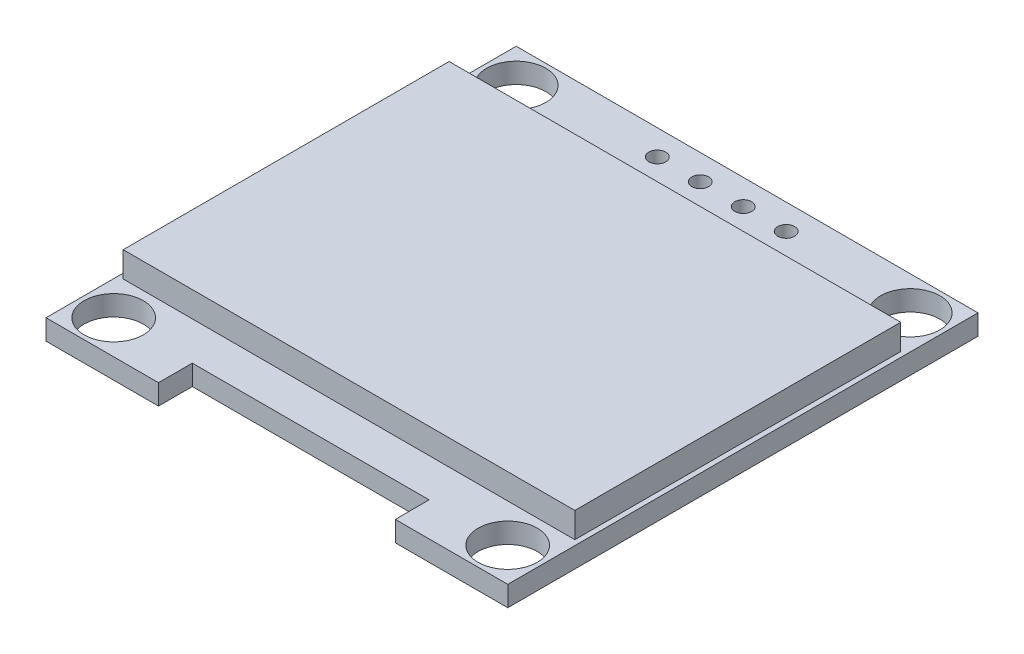
from build123d import *

# Parameters (mm, degrees)
ESQUISSE1_R             = 1.75
ESQUISSE1_R_2           = 0.5
BOSS_EXTRU_2_DEPTH      = 1.2
ESQUISSE9_W             = 26.7
ESQUISSE9_H             = 19.268
BOSS_EXTRU_3_DEPTH      = 1.5
ENL_V_MAT_EXTRU_1_DEPTH = 0.5


with BuildPart() as part:
    # Esquisse1 → Boss.-Extru.2 (new body)
    with BuildSketch(Plane(origin=(0, 0, 0), x_dir=(1, 0, 0), z_dir=(0, 1, 0))):
        Polygon((0, 0), (0, 27.8), (27.3, 27.8), (27.3, 0), (20.65, 0), (20.65, 2.0001046), (6.65, 2.0001046), (6.65, 0), align=None)
        with Locations(Location((25.29519694, 2.0001046, 0), (0, 0, 270))):
            Circle(ESQUISSE1_R, mode=Mode.SUBTRACT)
        with Locations(Location((2.002692778, 2.0001046, 0), (0, 0, 270))):
            Circle(ESQUISSE1_R, mode=Mode.SUBTRACT)
        with Locations(Location((25.29519694, 25.8, 0), (0, 0, 270))):
            Circle(ESQUISSE1_R, mode=Mode.SUBTRACT)
        with Locations(Location((2, 25.8, 0), (0, 0, 270))):
            Circle(ESQUISSE1_R, mode=Mode.SUBTRACT)
        with Locations(Location((9.84, 26.3, 0), (0, 0, 270))):
            Circle(ESQUISSE1_R_2, mode=Mode.SUBTRACT)
        with Locations(Location((17.46, 26.3, 0), (0, 0, 270))):
            Circle(ESQUISSE1_R_2, mode=Mode.SUBTRACT)
        with Locations(Location((12.38, 26.3, 0), (0, 0, 270))):
            Circle(ESQUISSE1_R_2, mode=Mode.SUBTRACT)
        with Locations(Location((14.92, 26.3, 0), (0, 0, 270))):
            Circle(ESQUISSE1_R_2, mode=Mode.SUBTRACT)
    extrude(amount=BOSS_EXTRU_2_DEPTH)

    # Esquisse9 → Boss.-Extru.3 (add)
    with BuildSketch(Plane(origin=(0, 1.2, 0), x_dir=(1, 0, 0), z_dir=(0, 1, 0))):
        with Locations((13.64759847, 13.9000523)):
            Rectangle(ESQUISSE9_W, ESQUISSE9_H)
    extrude(amount=BOSS_EXTRU_3_DEPTH)

    # Esquisse10 → Enlèv. mat.-Extru.1 (cut)
    # profile 1 of 8: a face of its own
    with BuildSketch(Plane(origin=(27.506922767, 0, -25.389295394), x_dir=(-1, 0, 0), z_dir=(0, -1, 0))):
        with BuildLine():
            add(Edge.make_bspline(
                [(4.410667941, -14.644029634), (4.475476047, -14.645671114), (4.602764514, -14.648895114), (4.789839411, -14.673574218), (4.968434507, -14.716269608), (5.140004645, -14.77313259), (5.302497622, -14.848986976), (5.457136514, -14.940672124), (5.603553388, -15.049148583), (5.73977477, -15.17357781), (5.86443172, -15.308961264), (5.974257606, -15.453439174), (6.0662999, -15.606137976), (6.141885687, -15.766598807), (6.201184297, -15.934458775), (6.242103341, -16.110612777), (6.268241491, -16.293919468), (6.271297268, -16.418946332), (6.272847428, -16.48237098)],
                knots=[0, 0, 0, 0, 1.065120563, 2.091984664, 3.0946048, 4.079830382, 5.057816894, 6.036188127, 7.030412546, 8.04752943, 9.064399622, 10.05169764, 11.02544977, 11.989514704, 12.962713494, 13.945757189, 14.957906945, 16, 16, 16, 16], degree=3))
            add(Edge.make_bspline(
                [(6.272847428, -16.48237098), (6.271297495, -16.545328427), (6.268242399, -16.669424847), (6.242073621, -16.851568291), (6.201032621, -17.026658988), (6.142436355, -17.194404641), (6.067210877, -17.354982204), (5.974555706, -17.507969158), (5.865414495, -17.653415657), (5.741207644, -17.789728322), (5.605806602, -17.914725793), (5.460576335, -18.023644668), (5.308783015, -18.117368793), (5.148473307, -18.192152467), (4.98177327, -18.251924387), (4.807190947, -18.292677017), (4.625544393, -18.31896406), (4.501673389, -18.321982576), (4.438712813, -18.323516814)],
                knots=[0, 0, 0, 0, 1.043624062, 2.057103931, 3.04512605, 4.022047818, 4.998200453, 5.980619268, 6.982898556, 8.009068085, 9.034988726, 10.034168286, 11.015286542, 11.987931943, 12.962482838, 13.94673481, 14.956375938, 16, 16, 16, 16], degree=3))
            add(Edge.make_bspline(
                [(4.438712813, -18.323516814), (4.375288494, -18.321967427), (4.250262278, -18.318913173), (4.066725242, -18.292731768), (3.890447498, -18.251790464), (3.721933147, -18.193281028), (3.561088218, -18.117663797), (3.407598135, -18.025459418), (3.262078988, -17.916052277), (3.125737241, -17.791885703), (3.000988043, -17.656714151), (2.892228667, -17.511879895), (2.800003554, -17.360224439), (2.724640221, -17.201326915), (2.664975762, -17.035955472), (2.624270944, -16.863006994), (2.597934992, -16.683467489), (2.594900145, -16.56122459), (2.593360248, -16.499197903)],
                knots=[0, 0, 0, 0, 1.053102029, 2.075944431, 3.073151272, 4.055350789, 5.033113405, 6.020478099, 7.024410459, 8.052272461, 9.079885166, 10.07527673, 11.055994387, 12.023226415, 12.992069828, 13.970394897, 14.97016774, 16, 16, 16, 16], degree=3))
            add(Edge.make_bspline(
                [(2.593360248, -16.499197903), (2.593894884, -16.457565234), (2.59495741, -16.374825111), (2.607749103, -16.251958511), (2.626310804, -16.131067853), (2.652912717, -16.012496905), (2.687704384, -15.89653592), (2.728756411, -15.782385157), (2.778896256, -15.671201434), (2.835576904, -15.562458042), (2.898838712, -15.457850136), (2.968714462, -15.358970553), (3.04274983, -15.264989556), (3.123913224, -15.178342552), (3.209529669, -15.096508896), (3.300988047, -15.020746179), (3.397730292, -14.950371228), (3.500172671, -14.886950887), (3.605790946, -14.829591752), (3.714667724, -14.780369901), (3.825324295, -14.73812384), (3.938278943, -14.703883015), (4.053231715, -14.676850979), (4.1704335, -14.658443625), (4.289790926, -14.645619307), (4.370202245, -14.644561805), (4.410667941, -14.644029634)],
                knots=[0, 0, 0, 0, 1.037015668, 2.060948919, 3.074880161, 4.083647147, 5.086022904, 6.090072063, 7.104153813, 8.122640571, 9.144368836, 10.147691507, 11.138137339, 12.123020368, 13.103399296, 14.087645067, 15.080126199, 16.082011238, 17.087798457, 18.072939717, 19.057185487, 20.037253025, 21.01195951, 21.997135196, 22.992090687, 24, 24, 24, 24], degree=3))
        make_face()
        with BuildLine():
            add(Edge.make_bspline(
                [(4.42609262, -15.003003993), (4.392877987, -15.003408883), (4.326766254, -15.004214793), (4.228481718, -15.014830509), (4.131489784, -15.029960398), (4.035770422, -15.051541918), (3.941724132, -15.080945971), (3.848474291, -15.114786879), (3.756871237, -15.15600797), (3.667217379, -15.202580674), (3.580302304, -15.254129595), (3.498289603, -15.311101362), (3.420966959, -15.372159916), (3.348523692, -15.437447754), (3.28117252, -15.507297356), (3.217587818, -15.580649792), (3.160318237, -15.659601683), (3.10783266, -15.74201209), (3.06086482, -15.827773671), (3.019099465, -15.915983533), (2.984935456, -16.00736122), (2.95707308, -16.100915378), (2.933973269, -16.196497837), (2.919339345, -16.294833686), (2.908606985, -16.395428798), (2.90784714, -16.463410652), (2.907462813, -16.49779566)],
                knots=[0, 0, 0, 0, 1.008559885, 2.007477868, 2.99961109, 3.989939068, 4.984837346, 5.991145699, 7.001802488, 8.033829008, 9.059044045, 10.069351652, 11.065060232, 12.050310815, 13.029377138, 14.011219647, 14.996725999, 15.989392538, 16.977580475, 17.965360261, 18.951710183, 19.937753436, 20.929683414, 21.935841486, 22.955955122, 24, 24, 24, 24], degree=3))
            add(Edge.make_bspline(
                [(2.907462813, -16.49779566), (2.908737675, -16.548357881), (2.911245722, -16.647829411), (2.933203292, -16.793597555), (2.967025267, -16.933685841), (3.016882633, -17.06732775), (3.079233248, -17.195672033), (3.156260138, -17.317580138), (3.247519224, -17.433085012), (3.35118275, -17.541380281), (3.464505457, -17.640226086), (3.584838187, -17.726989494), (3.710891794, -17.800399744), (3.842994997, -17.860204816), (3.980442536, -17.907594554), (4.124120087, -17.940073185), (4.273070547, -17.961448641), (4.374601202, -17.963501397), (4.42609262, -17.964542455)],
                knots=[0, 0, 0, 0, 1.032063989, 2.030389145, 3.003944642, 3.970395727, 4.937377036, 5.913328081, 6.909231446, 7.93887556, 8.970685674, 9.976071282, 10.964166581, 11.944589148, 12.933237628, 13.927779006, 14.949070134, 16, 16, 16, 16], degree=3))
            add(Edge.make_bspline(
                [(4.42609262, -17.964542455), (4.460702122, -17.96406695), (4.529343158, -17.963123882), (4.631438681, -17.953625206), (4.731694892, -17.938393336), (4.829971172, -17.916462681), (4.926155984, -17.889015474), (5.020650787, -17.856407746), (5.112449077, -17.815726542), (5.202708915, -17.770778591), (5.289105157, -17.719538433), (5.371580689, -17.664500284), (5.448056669, -17.603531663), (5.52044574, -17.53921385), (5.588073429, -17.470250003), (5.650482413, -17.396729781), (5.707462545, -17.318189123), (5.759928192, -17.235903718), (5.806731455, -17.149907465), (5.847510554, -17.061377787), (5.88210667, -16.970532678), (5.910035175, -16.877241106), (5.931920636, -16.781680257), (5.947000556, -16.683722179), (5.957548995, -16.583562837), (5.958344072, -16.515818981), (5.958744864, -16.481669859)],
                knots=[0, 0, 0, 0, 1.047197238, 2.076906641, 3.100256066, 4.114471768, 5.12198147, 6.126382909, 7.136867548, 8.15857795, 9.17633901, 10.174870724, 11.156907918, 12.133735059, 13.104061851, 14.077631395, 15.04955518, 16.038496417, 17.029181396, 18.010275684, 18.986308667, 19.968651475, 20.955262928, 21.950658345, 22.966943676, 24, 24, 24, 24], degree=3))
            add(Edge.make_bspline(
                [(5.958744864, -16.481669859), (5.958343751, -16.447754354), (5.957548069, -16.380476704), (5.947005595, -16.281015886), (5.931904704, -16.183762674), (5.910141996, -16.089098871), (5.882091843, -15.997000346), (5.847504512, -15.907553599), (5.806719213, -15.820425403), (5.759910988, -15.735831106), (5.707295165, -15.654656368), (5.649800922, -15.577053956), (5.586435573, -15.504481215), (5.519009549, -15.435146521), (5.445838663, -15.370528631), (5.367254369, -15.31060611), (5.284210691, -15.253932836), (5.196283456, -15.202807274), (5.105539502, -15.155593041), (5.012425544, -15.115142038), (4.917996445, -15.080769919), (4.822492332, -15.051452954), (4.725109354, -15.030044924), (4.626505525, -15.014816874), (4.526817267, -15.004218488), (4.459774047, -15.003410109), (4.42609262, -15.003003993)],
                knots=[0, 0, 0, 0, 1.02996197, 2.043119294, 3.035359645, 4.018872909, 4.991431989, 5.957985074, 6.929999688, 7.912076566, 8.892894881, 9.867085534, 10.843653904, 11.817741046, 12.803660682, 13.806313499, 14.818574707, 15.856120519, 16.894564902, 17.924820532, 18.937903209, 19.946497019, 20.957711757, 21.963978472, 22.977135795, 24, 24, 24, 24], degree=3))
        make_face(mode=Mode.SUBTRACT)
    # profile 2 of 8: a face of its own
    with BuildSketch(Plane(origin=(27.506922767, 0, -25.389295394), x_dir=(-1, 0, 0), z_dir=(0, -1, 0))):
        Polygon((6.990796146, -14.733773224), (7.30489871, -14.733773224), (7.30489871, -17.874798865), (8.651052556, -17.874798865), (8.651052556, -18.233773224), (6.990796146, -18.233773224), align=None)
    # profile 3 of 8: a face of its own
    with BuildSketch(Plane(origin=(27.506922767, 0, -25.389295394), x_dir=(-1, 0, 0), z_dir=(0, -1, 0))):
        Polygon((9.234385889, -14.733773224), (11.208744864, -14.733773224), (11.208744864, -15.092747583), (9.548488454, -15.092747583), (9.548488454, -16.16967066), (11.208744864, -16.16967066), (11.208744864, -16.528645019), (9.548488454, -16.528645019), (9.548488454, -17.874798865), (11.208744864, -17.874798865), (11.208744864, -18.233773224), (9.234385889, -18.233773224), align=None)
    # profile 4 of 8: a face of its own
    with BuildSketch(Plane(origin=(27.506922767, 0, -25.389295394), x_dir=(-1, 0, 0), z_dir=(0, -1, 0))):
        with BuildLine():
            Line((11.836949992, -18.233773224), (11.836949992, -14.733773224))
            Line((11.836949992, -14.733773224), (12.543680761, -14.733773224))
            add(Edge.make_bspline(
                [(12.543680761, -14.733773224), (12.605149749, -14.734215794), (12.723907515, -14.735070837), (12.895519962, -14.740492228), (13.054303725, -14.750082694), (13.199736584, -14.76405222), (13.332217796, -14.781205254), (13.451376404, -14.802705658), (13.557828547, -14.828093828), (13.623297987, -14.849739279), (13.654257684, -14.859975147)],
                knots=[0, 0, 0, 0, 1.314313732, 2.53924729, 3.670748893, 4.714932338, 5.66265055, 6.526160246, 7.303039223, 8, 8, 8, 8], degree=3))
            add(Edge.make_bspline(
                [(13.654257684, -14.859975147), (13.694752424, -14.875405853), (13.774823616, -14.905917347), (13.888830738, -14.963473648), (13.996156101, -15.02868675), (14.097375246, -15.101642613), (14.190176073, -15.184406961), (14.278183969, -15.273464047), (14.357798693, -15.372052387), (14.430706989, -15.478127375), (14.496442649, -15.590439427), (14.553581807, -15.708774536), (14.6010358, -15.832531744), (14.640429027, -15.961366892), (14.671475484, -16.09556327), (14.692657416, -16.235277136), (14.706628406, -16.379956325), (14.708032457, -16.478130789), (14.708744864, -16.527943897)],
                knots=[0, 0, 0, 0, 0.984719456, 1.947108742, 2.898477687, 3.838006223, 4.779231079, 5.722358779, 6.681677486, 7.655904652, 8.64651281, 9.637519902, 10.640069247, 11.656948941, 12.698408672, 13.768548281, 14.867775369, 16, 16, 16, 16], degree=3))
            add(Edge.make_bspline(
                [(14.708744864, -16.527943897), (14.708115896, -16.571205136), (14.70687645, -16.656455924), (14.695747134, -16.78209682), (14.679570814, -16.904010391), (14.654526616, -17.021616091), (14.624124103, -17.135944309), (14.585159952, -17.245776554), (14.540524456, -17.352120363), (14.488474577, -17.453537839), (14.431333192, -17.549621211), (14.370011449, -17.640196739), (14.304574753, -17.723971961), (14.234399121, -17.801200573), (14.160391404, -17.871766152), (14.082067073, -17.936258167), (13.999224023, -17.993414722), (13.9122333, -18.04548183), (13.818557171, -18.090902186), (13.716421305, -18.129332195), (13.605390127, -18.161178811), (13.48573617, -18.187749707), (13.357252692, -18.208827009), (13.219813726, -18.222953402), (13.073630436, -18.232506334), (12.973251171, -18.233342728), (12.921585409, -18.233773224)],
                knots=[0, 0, 0, 0, 1.105936401, 2.179363191, 3.223086493, 4.248585256, 5.251745608, 6.245858792, 7.225916811, 8.198733463, 9.158002045, 10.082870192, 10.993790845, 11.873723703, 12.748670949, 13.606408763, 14.465103618, 15.319838547, 16.196477973, 17.123216899, 18.106603292, 19.147568657, 20.255746949, 21.433717677, 22.679120308, 24, 24, 24, 24], degree=3))
            Line((12.921585409, -18.233773224), (11.836949992, -18.233773224))
        make_face()
        with BuildLine():
            Line((12.151052556, -17.874798865), (12.552795345, -17.874798865))
            add(Edge.make_bspline(
                [(12.552795345, -17.874798865), (12.610523715, -17.874550769), (12.721556514, -17.874073588), (12.881214511, -17.869886385), (13.027093908, -17.863044448), (13.159215417, -17.85346937), (13.277504441, -17.840800755), (13.382208191, -17.826675852), (13.472983449, -17.809078401), (13.527912886, -17.793127442), (13.553296146, -17.785756397)],
                knots=[0, 0, 0, 0, 1.375205317, 2.645023457, 3.804390687, 4.853969522, 5.800190428, 6.637939096, 7.370582563, 8, 8, 8, 8], degree=3))
            add(Edge.make_bspline(
                [(13.553296146, -17.785756397), (13.585244508, -17.774504839), (13.648378146, -17.752270466), (13.739259231, -17.711712804), (13.824016236, -17.663670735), (13.904126261, -17.610268461), (13.978452917, -17.549622459), (14.047877033, -17.48305147), (14.112258834, -17.410216695), (14.170933142, -17.331208533), (14.223441446, -17.246518738), (14.268912676, -17.156979904), (14.308764207, -17.063573094), (14.3400428, -16.964863935), (14.364558384, -16.861734877), (14.381923072, -16.754178663), (14.392737797, -16.642215381), (14.393999245, -16.566063257), (14.3946423, -16.527242775)],
                knots=[0, 0, 0, 0, 0.998632004, 1.973411704, 2.929992603, 3.868527914, 4.809262121, 5.754881198, 6.702106254, 7.672490631, 8.653608572, 9.636854334, 10.631411391, 11.644891563, 12.686317036, 13.754757253, 14.855430412, 16, 16, 16, 16], degree=3))
            add(Edge.make_bspline(
                [(14.3946423, -16.527242775), (14.394129012, -16.486309295), (14.393120655, -16.405895111), (14.380446344, -16.287904415), (14.361924789, -16.174423765), (14.335141103, -16.065445569), (14.301010224, -15.960757217), (14.258415582, -15.860937707), (14.209748963, -15.764932838), (14.151845626, -15.674958472), (14.088430033, -15.589865363), (14.018052153, -15.511910448), (13.941830115, -15.440916147), (13.860595265, -15.375776835), (13.772058166, -15.319113159), (13.678304475, -15.268426478), (13.577958804, -15.225410586), (13.508146108, -15.202531724), (13.472667139, -15.190904634)],
                knots=[0, 0, 0, 0, 1.122418816, 2.205001699, 3.251619955, 4.274784885, 5.280384055, 6.268708349, 7.249350384, 8.229342522, 9.199999885, 10.157847722, 11.105861043, 12.055065948, 13.010012805, 13.98527497, 14.976112212, 16, 16, 16, 16], degree=3))
            add(Edge.make_bspline(
                [(13.472667139, -15.190904634), (13.443315993, -15.182788206), (13.380907403, -15.165530454), (13.279067939, -15.146705081), (13.164452789, -15.130100582), (13.036553088, -15.116042543), (12.895514629, -15.105955222), (12.741228941, -15.098383907), (12.573629337, -15.093277274), (12.457446803, -15.092928567), (12.397146306, -15.092747583)],
                knots=[0, 0, 0, 0, 0.674548936, 1.434276114, 2.292660221, 3.240891867, 4.284742987, 5.42552168, 6.663806718, 8, 8, 8, 8], degree=3))
            Line((12.397146306, -15.092747583), (12.151052556, -15.092747583))
            Line((12.151052556, -15.092747583), (12.151052556, -17.874798865))
        make_face(mode=Mode.SUBTRACT)
    # profile 5 of 8: a face of its own
    with BuildSketch(Plane(origin=(27.506922767, 0, -25.389295394), x_dir=(-1, 0, 0), z_dir=(0, -1, 0))):
        with BuildLine():
            add(Edge.make_bspline(
                [(16.458744864, -16.485175468), (16.459072882, -16.42907808), (16.459710062, -16.320108096), (16.466798483, -16.161323453), (16.478573825, -16.012363164), (16.494711198, -15.873220098), (16.514349178, -15.743858334), (16.540564665, -15.624623577), (16.570377468, -15.51496397), (16.604929913, -15.414521922), (16.643917702, -15.321944219), (16.686351963, -15.235519017), (16.733916758, -15.155377085), (16.78389367, -15.080239295), (16.838305742, -15.0113356), (16.895604533, -14.947692937), (16.958026409, -14.890782187), (17.023449417, -14.838935884), (17.092465881, -14.793486413), (17.163108548, -14.753453674), (17.235863653, -14.719253807), (17.310929836, -14.692363371), (17.387632394, -14.670152524), (17.466239461, -14.654963577), (17.546880825, -14.645406668), (17.60131226, -14.644493), (17.628917139, -14.644029634)],
                knots=[0, 0, 0, 0, 1.646270934, 3.197905019, 4.663502075, 6.030701355, 7.308322542, 8.50163776, 9.611534131, 10.641858119, 11.616356847, 12.558055219, 13.465016945, 14.349605745, 15.204443733, 16.039544428, 16.859896111, 17.680448484, 18.487036065, 19.28249412, 20.06191084, 20.843045899, 21.620316918, 22.403196591, 23.190181807, 24, 24, 24, 24], degree=3))
            add(Edge.make_bspline(
                [(17.628917139, -14.644029634), (17.656752618, -14.644517449), (17.712108627, -14.64548756), (17.793949002, -14.654811503), (17.873898684, -14.670282626), (17.951616823, -14.6922036), (18.027741809, -14.719399277), (18.101678217, -14.753486394), (18.173885298, -14.793165262), (18.243215586, -14.839789139), (18.310430201, -14.891771415), (18.373878164, -14.950534084), (18.43356525, -15.015483803), (18.490240555, -15.085925667), (18.542296153, -15.163210752), (18.591869585, -15.245994862), (18.636241621, -15.335725727), (18.678976296, -15.430906194), (18.715863283, -15.534169853), (18.749129528, -15.644934614), (18.776008496, -15.764508801), (18.798397769, -15.892265046), (18.815742665, -16.028672529), (18.828375307, -16.173438845), (18.835048392, -16.326659235), (18.836305093, -16.431417084), (18.836949992, -16.485175468)],
                knots=[0, 0, 0, 0, 0.810914788, 1.612654377, 2.396697861, 3.181598691, 3.963628158, 4.749916497, 5.551656086, 6.361998678, 7.18212741, 8.025565596, 8.878627764, 9.750805457, 10.657531673, 11.591944965, 12.560506719, 13.57287815, 14.630710178, 15.753379473, 16.941251878, 18.199788006, 19.531962791, 20.947069417, 22.433333509, 24, 24, 24, 24], degree=3))
            add(Edge.make_bspline(
                [(18.836949992, -16.485175468), (18.836298407, -16.538699375), (18.835028822, -16.642988527), (18.828450115, -16.795519503), (18.815491484, -16.939517546), (18.799281495, -17.075328008), (18.776830532, -17.202385627), (18.749225366, -17.321130076), (18.718575043, -17.432074147), (18.680740249, -17.534308959), (18.639329539, -17.629260682), (18.594274343, -17.71792783), (18.546004517, -17.801094123), (18.493415772, -17.87809387), (18.437362358, -17.949472527), (18.37664457, -18.01397015), (18.312973984, -18.073140821), (18.245561569, -18.125792449), (18.175150017, -18.171877254), (18.10319094, -18.213091104), (18.028407557, -18.246323799), (17.952494604, -18.27485884), (17.874366238, -18.296659292), (17.794119848, -18.311733147), (17.712163612, -18.322304996), (17.656762047, -18.323111476), (17.628917139, -18.323516814)],
                knots=[0, 0, 0, 0, 1.561518951, 3.042555995, 4.452378317, 5.7783523, 7.031515105, 8.214008947, 9.334062868, 10.386615937, 11.391082383, 12.354592575, 13.286541444, 14.194233754, 15.072674879, 15.931287219, 16.775624067, 17.606195743, 18.42308326, 19.229000347, 20.022332153, 20.807536673, 21.593273796, 22.3848459, 23.188221202, 24, 24, 24, 24], degree=3))
            add(Edge.make_bspline(
                [(17.628917139, -18.323516814), (17.601313025, -18.323050458), (17.546883101, -18.322130896), (17.466230675, -18.312617165), (17.387948232, -18.297321662), (17.311649478, -18.275905058), (17.236942963, -18.249690221), (17.164846676, -18.215536538), (17.094558992, -18.176202469), (17.026267436, -18.131407047), (16.961255275, -18.080085364), (16.89915667, -18.023321075), (16.841531651, -17.959697664), (16.787897555, -17.890219741), (16.736923467, -17.815526499), (16.690034094, -17.734598126), (16.64666324, -17.647755515), (16.607019749, -17.554437604), (16.571871086, -17.453282677), (16.540823377, -17.343133498), (16.51630922, -17.223017862), (16.495326265, -17.093900495), (16.478401882, -16.955226564), (16.466847556, -16.806920786), (16.459706241, -16.649075577), (16.459071171, -16.540805803), (16.458744864, -16.485175468)],
                knots=[0, 0, 0, 0, 0.810891512, 1.598919785, 2.382837074, 3.152667961, 3.926044502, 4.706494248, 5.493654104, 6.291793342, 7.103789334, 7.925228297, 8.761435821, 9.622817696, 10.50288917, 11.416980706, 12.369136599, 13.353924996, 14.394355917, 15.514179734, 16.714354668, 17.994756427, 19.357759367, 20.818452758, 22.365282078, 24, 24, 24, 24], degree=3))
        make_face()
        with BuildLine():
            add(Edge.make_bspline(
                [(16.772847428, -16.483773224), (16.772966875, -16.530521923), (16.773198698, -16.621251968), (16.779254899, -16.753095229), (16.787505131, -16.876065557), (16.798146428, -16.990319094), (16.813949377, -17.095469106), (16.831656164, -17.192238789), (16.853204254, -17.280116026), (16.878699272, -17.359703837), (16.907738369, -17.432352906), (16.939444232, -17.499954121), (16.973504955, -17.563306057), (17.011624106, -17.621839666), (17.053139169, -17.67574583), (17.097112428, -17.725978662), (17.145185013, -17.770775643), (17.211688755, -17.824502498), (17.299485229, -17.880021632), (17.410105685, -17.928367722), (17.523774136, -17.958750178), (17.600925386, -17.962613934), (17.639433966, -17.964542455)],
                knots=[0, 0, 0, 0, 1.459021318, 2.831673884, 4.118529203, 5.306027144, 6.411944654, 7.436330062, 8.375795394, 9.233974572, 10.042671642, 10.816086306, 11.563610507, 12.285937304, 12.993564865, 13.685989202, 14.367179055, 15.041617293, 16.353048772, 17.594441528, 18.799311195, 20, 20, 20, 20], degree=3))
            add(Edge.make_bspline(
                [(17.639433966, -17.964542455), (17.678191638, -17.962944674), (17.755626961, -17.959752411), (17.868760756, -17.928953674), (17.978591026, -17.882484134), (18.064662967, -17.827536629), (18.13014551, -17.775208299), (18.1770625, -17.730593651), (18.220124549, -17.680637784), (18.260966624, -17.626738488), (18.298425699, -17.567866004), (18.332488837, -17.504303428), (18.363572185, -17.435874251), (18.38128123, -17.388104511), (18.390335409, -17.363681077)],
                knots=[0, 0, 0, 0, 1.353760809, 2.704726607, 4.075137775, 5.516104923, 6.260822281, 7.007110065, 7.778089737, 8.566572457, 9.372053459, 10.217411131, 11.088608312, 12, 12, 12, 12], degree=3))
            add(Edge.make_bspline(
                [(18.390335409, -17.363681077), (18.400887176, -17.332451337), (18.42231179, -17.269041573), (18.449923565, -17.170677921), (18.471668964, -17.067475157), (18.49123233, -16.96005004), (18.504585385, -16.847610339), (18.515333199, -16.730503955), (18.521663886, -16.608642593), (18.522448637, -16.525847602), (18.522847428, -16.483773224)],
                knots=[0, 0, 0, 0, 0.884706709, 1.796334032, 2.740027952, 3.714592787, 4.726048262, 5.777819803, 6.87074269, 8, 8, 8, 8], degree=3))
            add(Edge.make_bspline(
                [(18.522847428, -16.483773224), (18.522297239, -16.441705651), (18.521220951, -16.359412487), (18.517106963, -16.238894306), (18.506483389, -16.124426545), (18.49468427, -16.015516072), (18.477287049, -15.91276577), (18.458529242, -15.815315464), (18.43332803, -15.72437244), (18.406408255, -15.638512858), (18.375597859, -15.558712203), (18.341682125, -15.484598417), (18.305460366, -15.415813692), (18.266118126, -15.352546751), (18.224122443, -15.294514208), (18.178364893, -15.242879613), (18.130660521, -15.196042645), (18.063843335, -15.142580076), (17.976369045, -15.088068381), (17.867523398, -15.037902621), (17.754252753, -15.009094328), (17.677679299, -15.005032641), (17.639433966, -15.003003993)],
                knots=[0, 0, 0, 0, 1.31362396, 2.569729283, 3.763502607, 4.902122613, 5.988968491, 7.01645872, 7.998833611, 8.933434873, 9.825090667, 10.667526885, 11.477055099, 12.250526234, 12.991942729, 13.710640831, 14.402115721, 15.076753259, 16.378508321, 17.609869233, 18.806226677, 20, 20, 20, 20], degree=3))
            add(Edge.make_bspline(
                [(17.639433966, -15.003003993), (17.600723374, -15.00503544), (17.523231669, -15.009102034), (17.408783714, -15.037795288), (17.299079362, -15.087808253), (17.211836388, -15.142760626), (17.144972601, -15.195098937), (17.097889908, -15.240485391), (17.053743736, -15.290131646), (17.013076035, -15.344533561), (16.974986752, -15.402998928), (16.94000574, -15.465987693), (16.90848841, -15.533819057), (16.879403874, -15.606435492), (16.853831086, -15.686016437), (16.832737123, -15.77378543), (16.813250069, -15.870247322), (16.799454801, -15.97596683), (16.787191045, -16.090248983), (16.779309697, -16.213526302), (16.773178439, -16.345590682), (16.772959975, -16.436789841), (16.772847428, -16.483773224)],
                knots=[0, 0, 0, 0, 1.207732386, 2.417664972, 3.655092373, 4.956220595, 5.625982001, 6.301752483, 6.994047911, 7.697131622, 8.419323945, 9.170223765, 9.943494443, 10.752040957, 11.610060368, 12.549350801, 13.567764191, 14.679664412, 15.874934091, 17.154273443, 18.533957287, 20, 20, 20, 20], degree=3))
        make_face(mode=Mode.SUBTRACT)
    # profile 6 of 8: a face of its own
    with BuildSketch(Plane(origin=(27.506922767, 0, -25.389295394), x_dir=(-1, 0, 0), z_dir=(0, -1, 0))):
        with BuildLine():
            add(Edge.make_bspline(
                [(19.711949992, -17.695311685), (19.731440204, -17.696469852), (19.769648487, -17.698740303), (19.824887615, -17.714316976), (19.874882275, -17.741975637), (19.919414519, -17.778838415), (19.956120996, -17.823534078), (19.984765348, -17.873129987), (20.000206333, -17.92883158), (20.002460245, -17.967261255), (20.003616659, -17.986978352)],
                knots=[0, 0, 0, 0, 1.020151414, 1.999887582, 2.974338812, 3.990962822, 5.007586832, 5.987933904, 6.967670073, 8, 8, 8, 8], degree=3))
            add(Edge.make_bspline(
                [(20.003616659, -17.986978352), (20.002421058, -18.006221682), (20.000063351, -18.044169246), (19.984800743, -18.099450708), (19.955902692, -18.149077613), (19.9196677, -18.194379751), (19.874871266, -18.231320621), (19.82476942, -18.258743966), (19.769778161, -18.275435946), (19.731461838, -18.277562243), (19.711949992, -18.278645019)],
                knots=[0, 0, 0, 0, 1.009421747, 1.99056486, 2.972319754, 3.999869655, 5.017953583, 5.993804169, 6.978383603, 8, 8, 8, 8], degree=3))
            add(Edge.make_bspline(
                [(19.711949992, -18.278645019), (19.692424086, -18.277601422), (19.654304404, -18.275564047), (19.59951841, -18.25840124), (19.549111441, -18.23157778), (19.504323729, -18.194310871), (19.467785258, -18.149310727), (19.440159875, -18.099108931), (19.423569726, -18.044327493), (19.421387853, -18.00625285), (19.420283325, -17.986978352)],
                knots=[0, 0, 0, 0, 1.022052826, 1.995314843, 2.982371812, 4.00089066, 5.028879526, 6.005146991, 6.990147033, 8, 8, 8, 8], degree=3))
            add(Edge.make_bspline(
                [(19.420283325, -17.986978352), (19.421345425, -17.967228973), (19.423419043, -17.928670733), (19.440194703, -17.873471625), (19.467570915, -17.823303186), (19.50457631, -17.778906606), (19.549100606, -17.741719303), (19.599396811, -17.71465451), (19.654436352, -17.698614098), (19.69244629, -17.696431581), (19.711949992, -17.695311685)],
                knots=[0, 0, 0, 0, 1.032775665, 2.016367738, 2.991239715, 4.008302682, 5.025365648, 6.011011707, 6.979408107, 8, 8, 8, 8], degree=3))
        make_face()
    # profile 7 of 8: a face of its own
    with BuildSketch(Plane(origin=(27.506922767, 0, -25.389295394), x_dir=(-1, 0, 0), z_dir=(0, -1, 0))):
        with BuildLine():
            Line((21.21515512, -18.323516814), (20.964153518, -18.148937487))
            Line((20.964153518, -18.148937487), (21.937310569, -16.726361365))
            add(Edge.make_bspline(
                [(21.937310569, -16.726361365), (21.875219833, -16.733954428), (21.752959713, -16.748905593), (21.629822611, -16.751652248), (21.569221627, -16.753003993)],
                knots=[0, 0, 0, 0, 1.015715272, 2, 2, 2, 2], degree=3))
            add(Edge.make_bspline(
                [(21.569221627, -16.753003993), (21.532479579, -16.752062917), (21.460358152, -16.750215666), (21.354326499, -16.735573858), (21.252440939, -16.71302373), (21.154971583, -16.679374975), (21.061552078, -16.637556766), (20.972386365, -16.585699752), (20.887594474, -16.524693461), (20.808087064, -16.454860469), (20.735775325, -16.378182417), (20.671352028, -16.297026774), (20.617810896, -16.210450803), (20.57333431, -16.120220583), (20.539603857, -16.025039233), (20.515041319, -15.925989832), (20.499918965, -15.82237819), (20.498119869, -15.75185306), (20.497206402, -15.716044859)],
                knots=[0, 0, 0, 0, 1.060718605, 2.082097864, 3.085795603, 4.069760067, 5.054557537, 6.03741023, 7.043284206, 8.066802108, 9.088538119, 10.083643548, 11.053783639, 12.022749082, 12.983451788, 13.964007469, 14.966251758, 16, 16, 16, 16], degree=3))
            add(Edge.make_bspline(
                [(20.497206402, -15.716044859), (20.498940837, -15.667076206), (20.502345181, -15.570960674), (20.529743698, -15.430526905), (20.574804037, -15.297740362), (20.637632414, -15.172950168), (20.716767135, -15.057951429), (20.811875726, -14.954342819), (20.92237969, -14.863597966), (21.045761709, -14.785593888), (21.17911473, -14.722858891), (21.318783388, -14.67661959), (21.463697508, -14.649420843), (21.561865178, -14.645834981), (21.611288934, -14.644029634)],
                knots=[0, 0, 0, 0, 1.022988612, 2.007919123, 2.978103895, 3.94594894, 4.918897164, 5.887013414, 6.875921846, 7.89917871, 8.930658928, 9.948724884, 10.967259574, 12, 12, 12, 12], degree=3))
            add(Edge.make_bspline(
                [(21.611288934, -14.644029634), (21.659777354, -14.645859797), (21.755585901, -14.649476027), (21.896474907, -14.675959996), (22.031415924, -14.720596669), (22.159660911, -14.782281233), (22.278400323, -14.85960214), (22.385176134, -14.951736664), (22.477551673, -15.058742191), (22.555375554, -15.178030681), (22.617845595, -15.306197662), (22.662917878, -15.439981585), (22.690663516, -15.578420306), (22.694159844, -15.67221478), (22.695924351, -15.719550468)],
                knots=[0, 0, 0, 0, 1.026385292, 2.028040595, 3.023318987, 4.028184125, 5.03290303, 6.015178782, 7.004435299, 8.016004309, 9.023023918, 10.015172535, 10.998308025, 12, 12, 12, 12], degree=3))
            add(Edge.make_bspline(
                [(22.695924351, -15.719550468), (22.694745942, -15.756294235), (22.692355834, -15.830819775), (22.675619527, -15.944050118), (22.647199342, -16.059501348), (22.614947643, -16.157222943), (22.583815476, -16.237931393), (22.554514344, -16.301682973), (22.52200219, -16.368784236), (22.484083425, -16.438531574), (22.443321128, -16.511814109), (22.397261852, -16.587896825), (22.34695628, -16.666881818), (22.31112656, -16.720128906), (22.292779319, -16.747395019)],
                knots=[0, 0, 0, 0, 1.179839688, 2.393009684, 3.667231171, 4.993948276, 5.694988576, 6.444077775, 7.246288328, 8.089075292, 8.993003841, 9.939041771, 10.944649915, 12, 12, 12, 12], degree=3))
            Line((22.292779319, -16.747395019), (21.21515512, -18.323516814))
        make_face()
        with BuildLine():
            add(Edge.make_bspline(
                [(21.627414736, -16.394029634), (21.65524875, -16.39326925), (21.709432113, -16.391789042), (21.788809412, -16.3827798), (21.863733615, -16.366805814), (21.934404865, -16.343886102), (22.001531766, -16.316229433), (22.064048095, -16.281017447), (22.12200617, -16.239000812), (22.175794097, -16.191790796), (22.223558097, -16.139340213), (22.266101127, -16.084443106), (22.302261695, -16.026858496), (22.330824972, -15.965865234), (22.354309547, -15.902948025), (22.370527559, -15.83709367), (22.379511893, -15.768645269), (22.381043468, -15.722146611), (22.381821787, -15.698516814)],
                knots=[0, 0, 0, 0, 1.163407946, 2.26475976, 3.333800367, 4.359385343, 5.366239384, 6.363380779, 7.350133999, 8.353570782, 9.349036268, 10.310270964, 11.253520213, 12.184142, 13.120487599, 14.056272588, 15.012232024, 16, 16, 16, 16], degree=3))
            add(Edge.make_bspline(
                [(22.381821787, -15.698516814), (22.381152118, -15.674877148), (22.379832452, -15.628292288), (22.369245153, -15.559742549), (22.35061993, -15.494049288), (22.325629445, -15.430852858), (22.292709207, -15.370672486), (22.253205721, -15.312752614), (22.206273272, -15.257460486), (22.152270705, -15.206096503), (22.094036152, -15.158748604), (22.031975652, -15.116962528), (21.966600736, -15.081941331), (21.898310246, -15.053042361), (21.826961897, -15.030490586), (21.752597909, -15.014273221), (21.674842504, -15.005301466), (21.622061218, -15.003779572), (21.595163133, -15.003003993)],
                knots=[0, 0, 0, 0, 0.972161553, 1.915763587, 2.844109794, 3.775983486, 4.705125789, 5.659731448, 6.655561913, 7.682237399, 8.721216875, 9.739758359, 10.754845918, 11.767244016, 12.7857855, 13.828538656, 14.893392813, 16, 16, 16, 16], degree=3))
            add(Edge.make_bspline(
                [(21.595163133, -15.003003993), (21.56849898, -15.003780825), (21.51618413, -15.005304962), (21.439119971, -15.014256167), (21.365258803, -15.030599652), (21.294117183, -15.053031915), (21.225828722, -15.081943487), (21.16045689, -15.116964363), (21.098381873, -15.158738985), (21.040203152, -15.206133757), (20.98610523, -15.257221403), (20.939979701, -15.312994832), (20.900385809, -15.370642357), (20.867510806, -15.430860865), (20.842508289, -15.494047151), (20.823886287, -15.559743127), (20.813298122, -15.628292138), (20.811978575, -15.674877098), (20.811308966, -15.698516814)],
                knots=[0, 0, 0, 0, 1.099389452, 2.15699305, 3.192601482, 4.213358962, 5.227959689, 6.245255729, 7.266013209, 8.307253147, 9.336162325, 10.327954924, 11.284637477, 12.215801273, 13.149702402, 14.080068371, 15.025723358, 16, 16, 16, 16], degree=3))
            add(Edge.make_bspline(
                [(20.811308966, -15.698516814), (20.811914893, -15.722165012), (20.81310989, -15.768803589), (20.824637679, -15.837329981), (20.843915959, -15.903018175), (20.86973535, -15.966506882), (20.90373694, -16.027178741), (20.945460788, -16.084746103), (20.994366334, -16.139861553), (21.049799822, -16.191668765), (21.110467983, -16.23922094), (21.175264729, -16.280751322), (21.243074566, -16.315823767), (21.314136196, -16.34396515), (21.387922996, -16.366576814), (21.465098128, -16.382750359), (21.545406365, -16.391702626), (21.599816347, -16.393246523), (21.627414736, -16.394029634)],
                knots=[0, 0, 0, 0, 0.952633368, 1.87876736, 2.791047057, 3.707742249, 4.635551637, 5.587206343, 6.568248508, 7.601284464, 8.641511608, 9.671105535, 10.699146789, 11.713763218, 12.747829548, 13.806491675, 14.887386225, 16, 16, 16, 16], degree=3))
        make_face(mode=Mode.SUBTRACT)
    # profile 8 of 8: a face of its own
    with BuildSketch(Plane(origin=(27.506922767, 0, -25.389295394), x_dir=(-1, 0, 0), z_dir=(0, -1, 0))):
        with BuildLine():
            Line((24.760026915, -14.644029634), (25.001913934, -14.834033641))
            Line((25.001913934, -14.834033641), (24.077134287, -16.248196301))
            add(Edge.make_bspline(
                [(24.077134287, -16.248196301), (24.138704564, -16.23838244), (24.258804351, -16.219239395), (24.380370249, -16.21608145), (24.439614255, -16.214542455)],
                knots=[0, 0, 0, 0, 1.025318673, 2, 2, 2, 2], degree=3))
            add(Edge.make_bspline(
                [(24.439614255, -16.214542455), (24.475186751, -16.215498566), (24.545210152, -16.217380644), (24.648016954, -16.231864495), (24.74680589, -16.254689606), (24.841167502, -16.287961862), (24.931440484, -16.330464217), (25.01814288, -16.381403087), (25.09964489, -16.443408767), (25.176996069, -16.512673723), (25.247223167, -16.589390708), (25.309399222, -16.670792044), (25.361626014, -16.756792925), (25.403999936, -16.847349791), (25.436904814, -16.942323051), (25.460892459, -17.04159119), (25.475072052, -17.145222662), (25.476997543, -17.215700837), (25.477975633, -17.251501589)],
                knots=[0, 0, 0, 0, 1.04369286, 2.054478336, 3.041073146, 4.015093852, 4.984733326, 5.965804835, 6.960378782, 7.985147595, 9.009457201, 10.008161701, 10.986880575, 11.956520048, 12.937015923, 13.931873656, 14.949455224, 16, 16, 16, 16], degree=3))
            add(Edge.make_bspline(
                [(25.477975633, -17.251501589), (25.476552528, -17.300481293), (25.473752195, -17.396861759), (25.445848399, -17.537238466), (25.402488754, -17.670970981), (25.340511225, -17.795924153), (25.263528842, -17.911926722), (25.16965125, -18.014712188), (25.062207761, -18.106382225), (24.940720963, -18.183038844), (24.809977999, -18.245641895), (24.672626002, -18.290607137), (24.529998855, -18.318290607), (24.433194247, -18.321761209), (24.384225633, -18.323516814)],
                knots=[0, 0, 0, 0, 1.031375318, 2.029502543, 3.004789286, 3.987476834, 4.960371455, 5.9300674, 6.912260825, 7.929083631, 8.949397511, 9.960523116, 10.96833055, 12, 12, 12, 12], degree=3))
            add(Edge.make_bspline(
                [(24.384225633, -18.323516814), (24.337128932, -18.321988608), (24.243838614, -18.3189615), (24.10660582, -18.291995562), (23.974742803, -18.248288459), (23.849173422, -18.188074181), (23.732852809, -18.112016298), (23.628787173, -18.020454019), (23.537495398, -17.915344554), (23.461520777, -17.796704206), (23.401262045, -17.669214249), (23.35607212, -17.536277092), (23.329675877, -17.398377111), (23.32598732, -17.304895972), (23.324129479, -17.257811685)],
                knots=[0, 0, 0, 0, 1.012016664, 2.004627821, 2.994792927, 3.992885782, 4.990978636, 5.973936114, 6.964471063, 7.975201453, 8.993600317, 9.990122807, 10.98767138, 12, 12, 12, 12], degree=3))
            add(Edge.make_bspline(
                [(23.324129479, -17.257811685), (23.325310924, -17.221767102), (23.327723209, -17.14817095), (23.3445666, -17.036706922), (23.371631394, -16.922655841), (23.401941641, -16.825901647), (23.433967251, -16.746640125), (23.46061979, -16.682736634), (23.493793786, -16.616975561), (23.529167168, -16.547101925), (23.569924036, -16.474916493), (23.614239686, -16.399212823), (23.663339337, -16.321194895), (23.697759499, -16.2682507), (23.715355441, -16.241185083)],
                knots=[0, 0, 0, 0, 1.173818275, 2.396712641, 3.66331629, 4.989737886, 5.693666774, 6.447286557, 7.243889047, 8.091586357, 8.998013824, 9.943181721, 10.948533338, 12, 12, 12, 12], degree=3))
            Line((23.715355441, -16.241185083), (24.760026915, -14.644029634))
        make_face()
        with BuildLine():
            add(Edge.make_bspline(
                [(24.373708806, -16.573516814), (24.347046561, -16.574294857), (24.294967452, -16.575814603), (24.218560037, -16.584639855), (24.146246786, -16.60125892), (24.077069652, -16.622425252), (24.012321949, -16.651528312), (23.951533109, -16.686880111), (23.894468057, -16.728501289), (23.841724506, -16.7758022), (23.793904842, -16.827590233), (23.752723712, -16.883059755), (23.717201311, -16.940873958), (23.688319493, -17.001515901), (23.665829417, -17.0649624), (23.649561166, -17.13092165), (23.640507415, -17.199835956), (23.639001183, -17.246568458), (23.638232043, -17.270431878)],
                knots=[0, 0, 0, 0, 1.129588631, 2.206414736, 3.251139165, 4.268635594, 5.265702196, 6.250456724, 7.242448911, 8.251968645, 9.246821453, 10.222880186, 11.173611482, 12.116736599, 13.062300278, 14.020270554, 14.989073742, 16, 16, 16, 16], degree=3))
            add(Edge.make_bspline(
                [(23.638232043, -17.270431878), (23.638858405, -17.294081858), (23.640086606, -17.340455947), (23.651238926, -17.408795127), (23.668274009, -17.474560035), (23.693614404, -17.537411634), (23.723841293, -17.598307952), (23.763746617, -17.655043238), (23.807963403, -17.711063308), (23.860817336, -17.762064779), (23.917540699, -17.809521403), (23.978141902, -17.851001657), (24.041301861, -17.88648783), (24.107873284, -17.914298928), (24.176911667, -17.937123215), (24.248992222, -17.953184694), (24.324165077, -17.96226522), (24.375087015, -17.963773414), (24.401052556, -17.964542455)],
                knots=[0, 0, 0, 0, 0.989467248, 1.94019797, 2.891935182, 3.827694429, 4.772920941, 5.730924762, 6.725747692, 7.756678648, 8.79901574, 9.819492441, 10.826891316, 11.826466727, 12.835195252, 13.867842842, 14.912794438, 16, 16, 16, 16], degree=3))
            add(Edge.make_bspline(
                [(24.401052556, -17.964542455), (24.427018055, -17.963773353), (24.477939909, -17.962265041), (24.553113369, -17.953185373), (24.625191688, -17.937120725), (24.694238197, -17.914307954), (24.760779628, -17.886454345), (24.823884349, -17.851222425), (24.883912443, -17.809266307), (24.940673042, -17.762145879), (24.993306981, -17.710773027), (25.03858426, -17.655543305), (25.077267493, -17.597849409), (25.10870168, -17.53765152), (25.133762971, -17.474522032), (25.150884438, -17.408805308), (25.162013727, -17.340453282), (25.163245094, -17.294080957), (25.163873069, -17.270431878)],
                knots=[0, 0, 0, 0, 1.087397944, 2.132534446, 3.165364764, 4.174271784, 5.174024072, 6.181601208, 7.194203697, 8.236725232, 9.267838612, 10.269026844, 11.221737037, 12.171628256, 13.107553087, 14.05945871, 15.010357665, 16, 16, 16, 16], degree=3))
            add(Edge.make_bspline(
                [(25.163873069, -17.270431878), (25.163322776, -17.246537327), (25.16224273, -17.199640094), (25.150026781, -17.130952476), (25.133084407, -17.06462727), (25.107501377, -17.001081321), (25.074264832, -16.940565394), (25.033781425, -16.882773793), (24.986948855, -16.827263445), (24.932851315, -16.775700637), (24.873961081, -16.728553559), (24.811345496, -16.686934003), (24.745837522, -16.651809026), (24.677503579, -16.622501924), (24.605560697, -16.60135245), (24.531170358, -16.584699207), (24.453381115, -16.575837189), (24.400604507, -16.574300124), (24.373708806, -16.573516814)],
                knots=[0, 0, 0, 0, 0.978206639, 1.919901502, 2.851605144, 3.780102724, 4.718870031, 5.675451981, 6.667674623, 7.690630536, 8.733308323, 9.756129687, 10.767539656, 11.776269907, 12.797430371, 13.836405707, 14.897401972, 16, 16, 16, 16], degree=3))
        make_face(mode=Mode.SUBTRACT)
    extrude(amount=-ENL_V_MAT_EXTRU_1_DEPTH, mode=Mode.SUBTRACT)


solid = part.part
